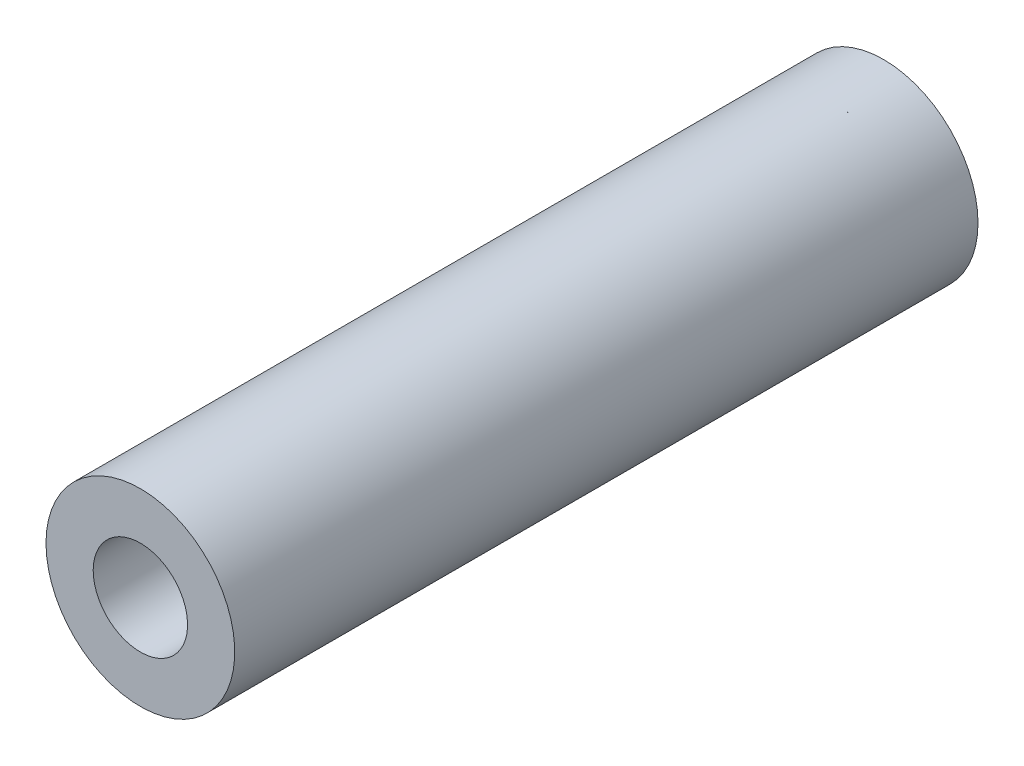
from build123d import *

# Parameters (mm, degrees)
SKETCH1_R           = 6.35
SKETCH1_R_2         = 3.175
BOSS_EXTRUDE1_DEPTH = 50.0126


with BuildPart() as part:
    # Sketch1 → Boss-Extrude1 (new body)
    with BuildSketch(Plane.XY):
        with Locations(Location((55.5752, -55.5752, 0), (0, 0, 180))):
            Circle(SKETCH1_R)
        with Locations(Location((55.5752, -55.5752, 0), (0, 0, 180))):
            Circle(SKETCH1_R_2, mode=Mode.SUBTRACT)
    extrude(amount=BOSS_EXTRUDE1_DEPTH)


solid = part.part
